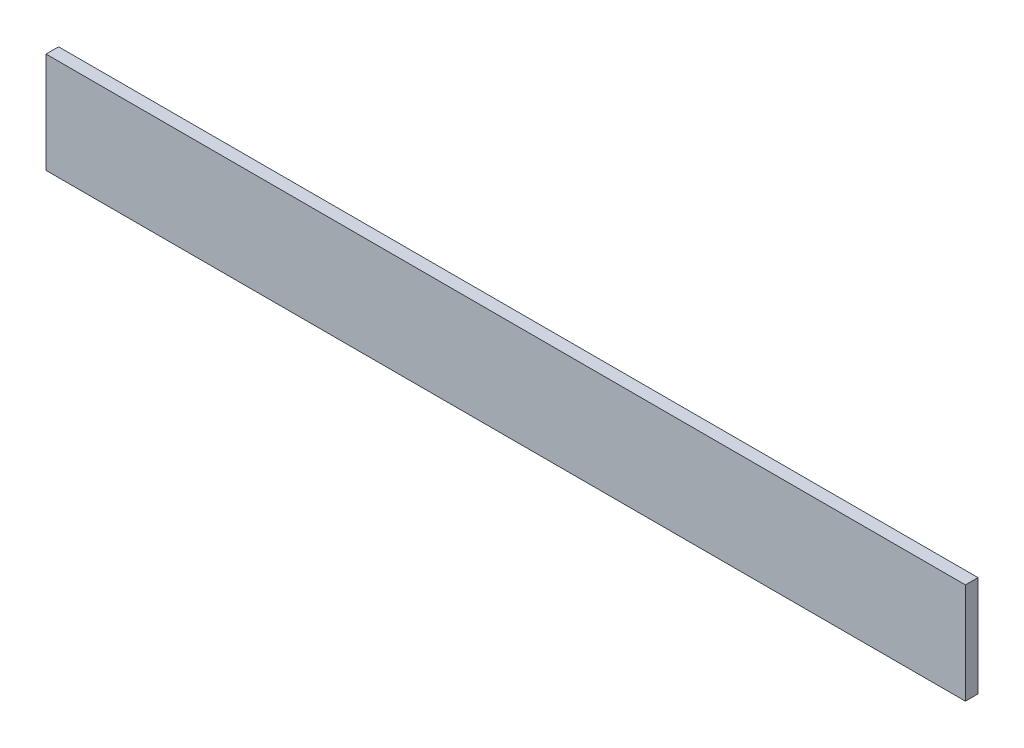
from build123d import *

# Parameters (mm, degrees)
ESQUISSE1_W        = 365
ESQUISSE1_H        = 40
BOSS_EXTRU_1_DEPTH = 5


with BuildPart() as part:
    # Esquisse1 → Boss.-Extru.1 (new body)
    with BuildSketch(Plane.XY):
        Rectangle(ESQUISSE1_W, ESQUISSE1_H)
    extrude(amount=BOSS_EXTRU_1_DEPTH)


solid = part.part
